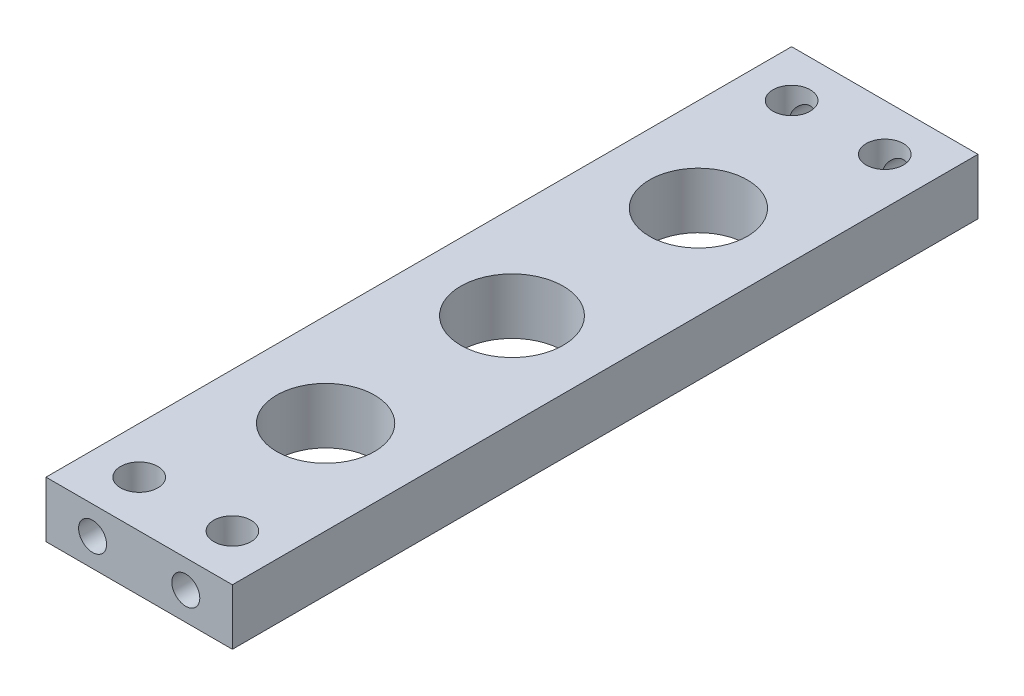
from build123d import *

# Parameters (mm, degrees)
SKETCH1_W           = 40
SKETCH1_H           = 160
SKETCH1_R           = 11
SKETCH1_R_2         = 10.5
BOSS_EXTRUDE1_DEPTH = 12
CUT_EXTRUDE3_REACH  = 85.331
SKETCH4_R           = 4
CUT_EXTRUDE4_REACH  = 163.691
SKETCH5_R           = 3


with BuildPart() as part:
    # Sketch1 → Boss-Extrude1 (new body)
    with BuildSketch(Plane(origin=(0, 0, 0), x_dir=(1, 0, 0), z_dir=(0, 1, 0))):
        Rectangle(SKETCH1_W, SKETCH1_H)
        with Locations(Location((0, 0, 0), (0, 0, 270))):
            Circle(SKETCH1_R, mode=Mode.SUBTRACT)
        with Locations(Location((0, 40, 0), (0, 0, 270))):
            Circle(SKETCH1_R_2, mode=Mode.SUBTRACT)
        with Locations(Location((0, -40, 0), (0, 0, 270))):
            Circle(SKETCH1_R_2, mode=Mode.SUBTRACT)
    extrude(amount=BOSS_EXTRUDE1_DEPTH)

    # Sketch4 → Cut-Extrude3 (cut, up to next)
    with BuildSketch(Plane(origin=(0, 12, 0), x_dir=(1, 0, 0), z_dir=(0, 1, 0)), mode=Mode.PRIVATE) as cut_extrude3_sk1:
        with Locations(Location((-10, 70, 0), (0, 0, 270))):
            Circle(SKETCH4_R)
    cut_extrude3_tool1 = extrude(cut_extrude3_sk1.sketch, amount=-CUT_EXTRUDE3_REACH, mode=Mode.PRIVATE) & part.part
    # Sketch4 → Cut-Extrude3 (cut, up to next)
    with BuildSketch(Plane(origin=(0, 12, 0), x_dir=(1, 0, 0), z_dir=(0, 1, 0)), mode=Mode.PRIVATE) as cut_extrude3_sk2:
        with Locations(Location((10, 70, 0), (0, 0, 270))):
            Circle(SKETCH4_R)
    cut_extrude3_tool2 = extrude(cut_extrude3_sk2.sketch, amount=-CUT_EXTRUDE3_REACH, mode=Mode.PRIVATE) & part.part
    cut_extrude3_1 = cut_extrude3_tool1.solids().sort_by_distance((-10, 12, -70))[0]
    add(cut_extrude3_1, mode=Mode.SUBTRACT)
    cut_extrude3_2 = cut_extrude3_tool2.solids().sort_by_distance((10, 12, -70))[0]
    add(cut_extrude3_2, mode=Mode.SUBTRACT)
    cut_extrude3 = cut_extrude3_1 + cut_extrude3_2  # Cut-Extrude3 as one shape, for the pattern or mirror that repeats it

    # Sketch5 → Cut-Extrude4 (cut, up to next)
    with BuildSketch(Plane(origin=(0, 0, -80), x_dir=(-1, 0, 0), z_dir=(0, 0, -1)), mode=Mode.PRIVATE) as cut_extrude4_sk1:
        with Locations((10, 6)):
            Circle(SKETCH5_R)
    cut_extrude4_tool1 = extrude(cut_extrude4_sk1.sketch, amount=-CUT_EXTRUDE4_REACH, mode=Mode.PRIVATE) & part.part
    # Sketch5 → Cut-Extrude4 (cut, up to next)
    with BuildSketch(Plane(origin=(0, 0, -80), x_dir=(-1, 0, 0), z_dir=(0, 0, -1)), mode=Mode.PRIVATE) as cut_extrude4_sk2:
        with Locations((-10, 6)):
            Circle(SKETCH5_R)
    cut_extrude4_tool2 = extrude(cut_extrude4_sk2.sketch, amount=-CUT_EXTRUDE4_REACH, mode=Mode.PRIVATE) & part.part
    cut_extrude4_1 = cut_extrude4_tool1.solids().sort_by_distance((-10, 6, -80))[0]
    add(cut_extrude4_1, mode=Mode.SUBTRACT)
    cut_extrude4_2 = cut_extrude4_tool2.solids().sort_by_distance((10, 6, -80))[0]
    add(cut_extrude4_2, mode=Mode.SUBTRACT)
    cut_extrude4 = cut_extrude4_1 + cut_extrude4_2  # Cut-Extrude4 as one shape, for the pattern or mirror that repeats it

    # Mirror1: Cut-Extrude3, Cut-Extrude4 across plane
    add(cut_extrude3.mirror(Plane.XY), mode=Mode.SUBTRACT)
    add(cut_extrude4.mirror(Plane.XY), mode=Mode.SUBTRACT)


solid = part.part
